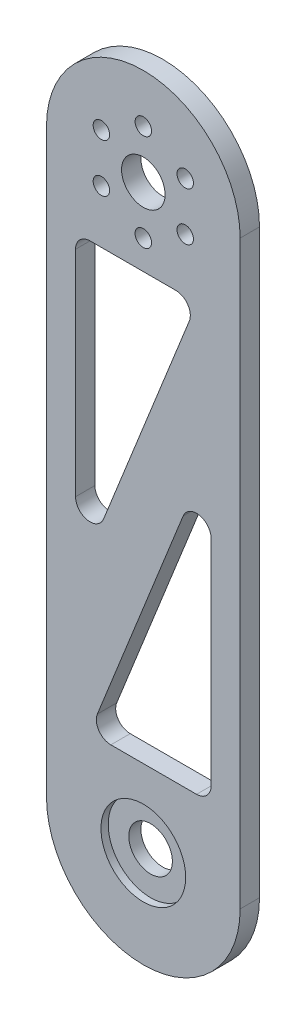
from build123d import *

# Parameters (mm, degrees)
SKETCH_1_R          = 4.5
EXTRUDE_2_DEPTH     = 4
CUT_EXTRUDE_1_DEPTH = 83.559069762
FILLET_1_R          = 3
SKETCH_6_R          = 1.7
CUT_EXTRUDE_2_DEPTH = 83.559069762
SKETCH_7_R          = 8.75
CUT_EXTRUDE_3_DEPTH = 1.5


with BuildPart() as part:
    # 草图1 → 凸台-拉伸2 (new body)
    with BuildSketch(Plane.XY):
        with BuildLine():
            Line((20, -60), (20, 60))
            ThreePointArc((20, 60), (0, 80), (-20, 60))
            Line((-20, 60), (-20, -60))
            ThreePointArc((-20, -60), (0, -80), (20, -60))
        make_face()
        with Locations((0, 60)):
            Circle(SKETCH_1_R, mode=Mode.SUBTRACT)
        with Locations((0, -60)):
            Circle(SKETCH_1_R, mode=Mode.SUBTRACT)
    extrude(amount=EXTRUDE_2_DEPTH)

    # 草图4 → 切除-拉伸1 (cut, through all)
    with BuildSketch(Plane.XY.offset(4)):
        Polygon((-14, -18.844505579), (11.137802231, 44), (-14, 44), align=None)
        Polygon((14, -44), (14, 18.844505579), (-11.137802231, -44), align=None)
    extrude(amount=-CUT_EXTRUDE_1_DEPTH, mode=Mode.SUBTRACT)

    # 圆角1
    fillet_1_edges = [part.edges().sort_by_distance(p)[0] for p in [
        (14, -44, 2),
        (-11.137802231, -44, 2),
        (14, 18.844505579, 2),
        (-14, -18.844505579, 2),
        (-14, 44, 2),
        (11.137802231, 44, 2),
    ]]
    fillet(fillet_1_edges, radius=FILLET_1_R)

    # 草图6 → 切除-拉伸2 (cut, through all)
    with BuildSketch(Plane.XY.offset(4)):
        with Locations((0, 50)):
            Circle(SKETCH_6_R)
        with Locations((-8.660254038, 55)):
            Circle(SKETCH_6_R)
        with Locations((-8.660254038, 65)):
            Circle(SKETCH_6_R)
        with Locations((0, 70)):
            Circle(SKETCH_6_R)
        with Locations((8.660254038, 65)):
            Circle(SKETCH_6_R)
        with Locations((8.660254038, 55)):
            Circle(SKETCH_6_R)
    extrude(amount=-CUT_EXTRUDE_2_DEPTH, mode=Mode.SUBTRACT)

    # 草图7 → 切除-拉伸3 (cut)
    with BuildSketch(Plane.XY.offset(4)):
        with Locations((0, -60)):
            Circle(SKETCH_7_R)
    extrude(amount=-CUT_EXTRUDE_3_DEPTH, mode=Mode.SUBTRACT)


solid = part.part
